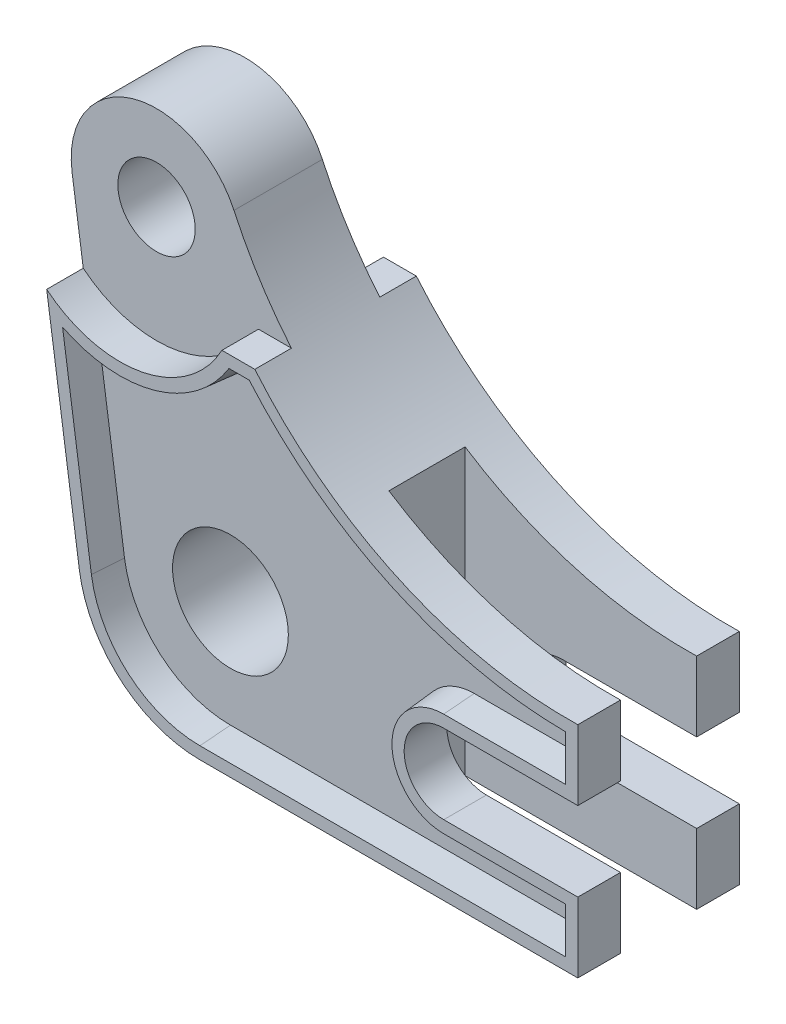
from build123d import *

# Parameters (mm, degrees)
SKETCH3_R               = 14
SKETCH3_R_2             = 6.35
SKETCH3_R_3             = 20
SKETCH3_R_4             = 9.5
BOSS_EXTRUDE6_DEPTH     = 26.5
CUT_EXTRUDE5_START      = 7
SKETCH7_W               = 38
SKETCH7_H               = 71.155333985
CUT_EXTRUDE5_DEPTH      = 12.5
CUT_EXTRUDE6_DEPTH      = 93.278112248
CUT_EXTRUDE6_DEPTH_BACK = 6
CUT_EXTRUDE8_DEPTH      = 93.278112248
CUT_EXTRUDE8_DEPTH_BACK = 6
CUT_EXTRUDE10_DEPTH     = 5
CUT_EXTRUDE10_TAPER     = 5
CUT_EXTRUDE11_DEPTH     = 5
CUT_EXTRUDE11_DRAFT     = -5


with BuildPart() as part:
    # Sketch3 → Boss-Extrude6 (new body)
    # profile 1 of 3: a face of its own
    with BuildSketch(Plane.XY):
        with BuildLine():
            ThreePointArc((0.870489571, 49), (-12.127650844, 35.035893248), (-26.986121482, 47.001417973))
            Line((-26.986121482, 47.001417973), (-19.795158647, -2.855117182))
            ThreePointArc((-19.795158647, -2.855117182), (-1.431227978, 19.948723931), (20, 0))
            ThreePointArc((20, 0), (14.142135624, -14.142135624), (0, -20))
            Line((0, -20), (62, -20))
            Line((62, -20), (62, -8.5))
            Line((62, -8.5), (40, -8.5))
            ThreePointArc((40, -8.5), (33.5, -2), (40, 4.5))
            Line((40, 4.5), (62, 4.5))
            Line((62, 4.5), (62, 16))
            ThreePointArc((62, 16), (24.979840385, 26.107737846), (-0.421043253, 54.873232673))
            ThreePointArc((-0.421043253, 54.873232673), (0.543794593, 52.006780632), (0.870489571, 49))
        make_face()
    # profile 2 of 3: a face of its own
    with BuildSketch(Plane.XY):
        with Locations((-13.129510429, 49)):
            Circle(SKETCH3_R)
        with Locations((-13.129510429, 49)):
            Circle(SKETCH3_R_2, mode=Mode.SUBTRACT)
    # profile 3 of 3: a face of its own
    with BuildSketch(Plane.XY):
        Circle(SKETCH3_R_3)
        Circle(SKETCH3_R_4, mode=Mode.SUBTRACT)
    extrude(amount=BOSS_EXTRUDE6_DEPTH)

    # Sketch7 → Cut-Extrude5 (cut)
    with BuildSketch(Plane.XY.offset(CUT_EXTRUDE5_START)):
        with Locations((43, 15.577666993)):
            Rectangle(SKETCH7_W, SKETCH7_H)
    extrude(amount=CUT_EXTRUDE5_DEPTH, mode=Mode.SUBTRACT)

    # Sketch8 → Cut-Extrude6 (cut, two sides: drawn at the far end of the back side and taken through both)
    with BuildSketch(Plane.XY.offset(26.5).offset(-CUT_EXTRUDE6_DEPTH_BACK)):
        with BuildLine():
            Line((-191.908254211, 170.560932392), (-25.15238927, 34.287747135))
            ThreePointArc((-25.15238927, 34.287747135), (-9.427586496, 30.364127088), (3.603690102, 40))
            Line((3.603690102, 40), (9.001095845, 40))
            Line((9.001095845, 40), (224.356382551, 40))
            Line((224.356382551, 40), (353.256649812, 450.969973536))
            Line((353.256649812, 450.969973536), (-63.007986949, 581.530905928))
            Line((-63.007986949, 581.530905928), (-191.908254211, 170.560932392))
        make_face()
    extrude(amount=CUT_EXTRUDE6_DEPTH + CUT_EXTRUDE6_DEPTH_BACK, mode=Mode.SUBTRACT)

    # Sketch9 → Cut-Extrude8 (cut, two sides: drawn at the far end of the back side and taken through both)
    with BuildSketch(Plane(origin=(0, 0, 0), x_dir=(-1, 0, 0), z_dir=(0, 0, -1)).offset(-CUT_EXTRUDE8_DEPTH_BACK)):
        with BuildLine():
            Line((191.908254211, 170.560932392), (25.15238927, 34.287747135))
            ThreePointArc((25.15238927, 34.287747135), (9.427586496, 30.364127088), (-3.603690102, 40))
            Line((-3.603690102, 40), (-9.001095845, 40))
            Line((-9.001095845, 40), (-224.356382551, 40))
            Line((-224.356382551, 40), (-353.256649812, 450.969973536))
            Line((-353.256649812, 450.969973536), (63.007986949, 581.530905928))
            Line((63.007986949, 581.530905928), (191.908254211, 170.560932392))
        make_face()
    extrude(amount=CUT_EXTRUDE8_DEPTH + CUT_EXTRUDE8_DEPTH_BACK, mode=Mode.SUBTRACT)

    # Sketch11 → Cut-Extrude10 (cut)
    with BuildSketch(Plane.XY):
        with BuildLine():
            Line((8.074790236, 38), (4.759033391, 38))
            ThreePointArc((4.759033391, 38), (-7.381776563, 28.801892282), (-22.54639569, 30.229750349))
            Line((-22.54639569, 30.229750349), (-17.815642783, -2.569605464))
            ThreePointArc((-17.815642783, -2.569605464), (-11.784462263, -13.606118079), (0, -18))
            Line((0, -18), (60, -18))
            Line((60, -18), (60, -10.5))
            Line((60, -10.5), (40, -10.5))
            ThreePointArc((40, -10.5), (31.5, -2), (40, 6.5))
            Line((40, 6.5), (60, 6.5))
            Line((60, 6.5), (60, 13.981994332))
            ThreePointArc((60, 13.981994332), (31.430822369, 20.355773383), (8.074790236, 38))
        make_face()
    extrude(amount=CUT_EXTRUDE10_DEPTH, taper=CUT_EXTRUDE10_TAPER, mode=Mode.SUBTRACT)


with BuildPart() as cut_extrude11_tool:
    # Sketch12 → Cut-Extrude11 (with draft: the straight prism first)
    with BuildSketch(Plane.XY.offset(26.5)):
        with BuildLine():
            Line((8.074790236, 38), (4.759033391, 38))
            ThreePointArc((4.759033391, 38), (-7.381776563, 28.801892282), (-22.54639569, 30.229750349))
            Line((-22.54639569, 30.229750349), (-17.815642783, -2.569605464))
            ThreePointArc((-17.815642783, -2.569605464), (-11.784462263, -13.606118079), (0, -18))
            Line((0, -18), (60, -18))
            Line((60, -18), (60, -10.5))
            Line((60, -10.5), (40, -10.5))
            ThreePointArc((40, -10.5), (31.5, -2), (40, 6.5))
            Line((40, 6.5), (60, 6.5))
            Line((60, 6.5), (60, 13.981994332))
            ThreePointArc((60, 13.981994332), (31.430822369, 20.355773383), (8.074790236, 38))
        make_face()
    extrude(amount=-CUT_EXTRUDE11_DEPTH)
    # Cut-Extrude11: the draft: its side faces are tilted about the plane it starts from
    cut_extrude11_sides = [cut_extrude11_tool.faces().sort_by_distance(p)[0] for p in [
        (31.430822369, 20.355773383, 24),
        (6.416911814, 38, 24),
        (-7.381776563, 28.801892282, 24),
        (-20.181019237, 13.830072443, 24),
        (-11.784462263, -13.606118079, 24),
        (30, -18, 24),
        (60, -14.25, 24),
        (50, -10.5, 24),
        (31.5, -2, 24),
        (50, 6.5, 24),
        (60, 10.240997166, 24),
    ]]
    draft(cut_extrude11_sides, Plane.XY.offset(26.5), CUT_EXTRUDE11_DRAFT)


with BuildPart() as part_1:
    add(part.part)

    # Cut-Extrude11: cut by cut_extrude11_tool
    add(cut_extrude11_tool.part, mode=Mode.SUBTRACT)


solid = part_1.part
